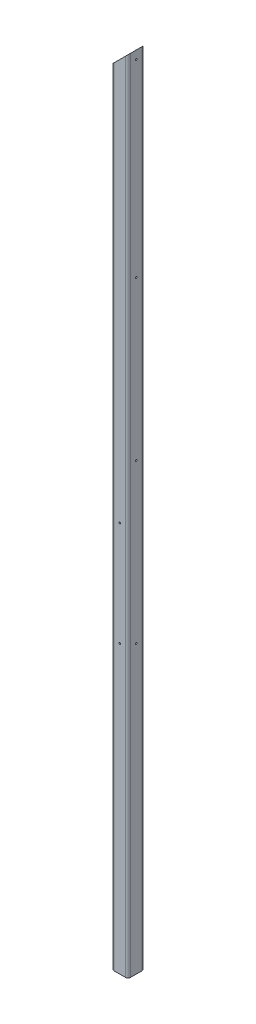
from build123d import *

# Parameters (mm, degrees)
TUBE_SQUARE_40_X_40_X_3_2_1_DEPTH = 1920
CUT_EXTRUDE1_DEPTH                = 1921.52076271
SKETCH16_R                        = 2
CUT_EXTRUDE2_DEPTH                = 3
SKETCH17_R                        = 2
CUT_EXTRUDE3_DEPTH                = 3


with BuildPart() as part:
    # Sketch15 → Tube (square) 40 X 40 X 3.2(1) (new body)
    with BuildSketch(Plane(origin=(0, 0, 0), x_dir=(-1, 0, 0), z_dir=(0, 1, 0))):
        with BuildLine():
            Line((-13.6, -20), (13.6, -20))
            ThreePointArc((13.6, -20), (18.1254834, -18.1254834), (20, -13.6))
            Line((20, -13.6), (20, 13.6))
            ThreePointArc((20, 13.6), (18.1254834, 18.1254834), (13.6, 20))
            Line((13.6, 20), (-13.6, 20))
            ThreePointArc((-13.6, 20), (-18.1254834, 18.1254834), (-20, 13.6))
            Line((-20, 13.6), (-20, -13.6))
            ThreePointArc((-20, -13.6), (-18.1254834, -18.1254834), (-13.6, -20))
        make_face()
        with BuildLine():
            Line((-13.6, -16.8), (13.6, -16.8))
            ThreePointArc((13.6, -16.8), (15.8627417, -15.8627417), (16.8, -13.6))
            Line((16.8, -13.6), (16.8, 13.6))
            ThreePointArc((16.8, 13.6), (15.8627417, 15.8627417), (13.6, 16.8))
            Line((13.6, 16.8), (-13.6, 16.8))
            ThreePointArc((-13.6, 16.8), (-15.8627417, 15.8627417), (-16.8, 13.6))
            Line((-16.8, 13.6), (-16.8, -13.6))
            ThreePointArc((-16.8, -13.6), (-15.8627417, -15.8627417), (-13.6, -16.8))
        make_face(mode=Mode.SUBTRACT)
    extrude(amount=TUBE_SQUARE_40_X_40_X_3_2_1_DEPTH)

    # Sketch13 → Cut-Extrude1 (cut, through all)
    with BuildSketch(Plane(origin=(0, 0, -20), x_dir=(-1, 0, 0), z_dir=(0, 0, -1))):
        Polygon((20, 1880), (-20, 1920), (20, 1920), align=None)
    extrude(amount=-CUT_EXTRUDE1_DEPTH, mode=Mode.SUBTRACT)

    # Sketch16 → Cut-Extrude2 (cut)
    with BuildSketch(Plane(origin=(20, 0, 0), x_dir=(0, 0, -1), z_dir=(1, 0, 0))):
        with Locations((0, 1900)):
            Circle(SKETCH16_R)
        with Locations((0, 1447)):
            Circle(SKETCH16_R)
        with Locations((0, 1067)):
            Circle(SKETCH16_R)
        with Locations((0, 687)):
            Circle(SKETCH16_R)
    extrude(amount=-CUT_EXTRUDE2_DEPTH, mode=Mode.SUBTRACT)

    # Sketch17 → Cut-Extrude3 (cut)
    with BuildSketch(Plane.XY.offset(20)):
        with Locations((0, 687)):
            Circle(SKETCH17_R)
        with Locations((0, 937)):
            Circle(SKETCH17_R)
    extrude(amount=-CUT_EXTRUDE3_DEPTH, mode=Mode.SUBTRACT)


solid = part.part
